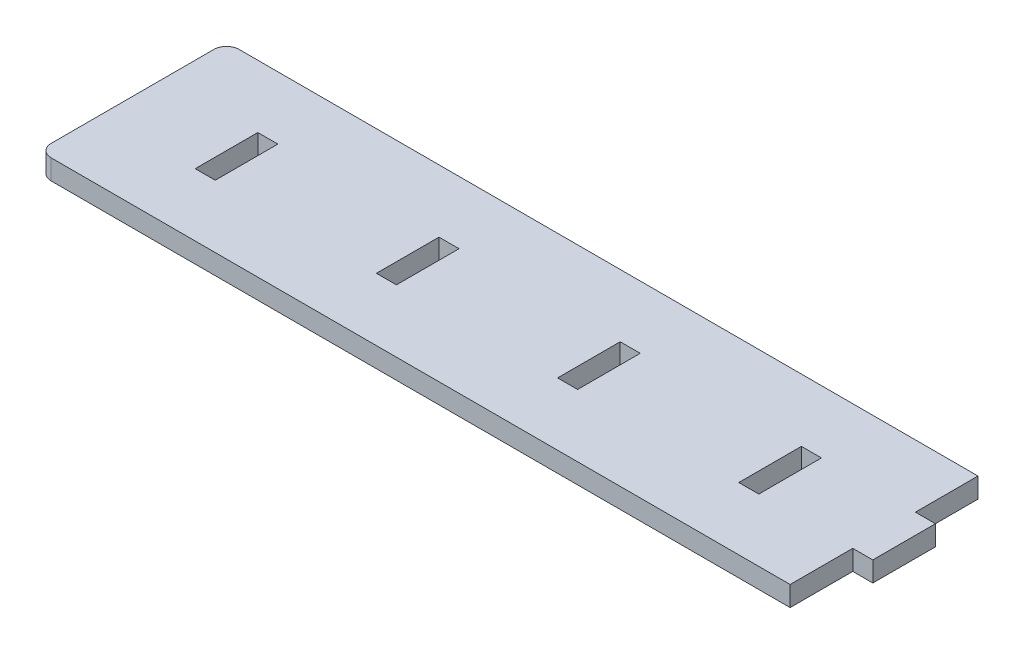
from build123d import *

# Parameters (mm, degrees)
BASE_SKETCH_W       = 3.2
BASE_SKETCH_H       = 10
BOSS_EXTRUDE1_DEPTH = 3.2
FILLET1_R           = 2


with BuildPart() as part:
    # Base_Sketch → Boss-Extrude1 (new body)
    with BuildSketch(Plane(origin=(0, 0, 0), x_dir=(1, 0, 0), z_dir=(0, 1, 0))):
        Polygon((-60, 15), (60, 15), (60, 5), (63.2, 5), (63.2, -5), (60, -5), (60, -15), (-60, -15), align=None)
        with Locations((-14.466666667, 0)):
            Rectangle(BASE_SKETCH_W, BASE_SKETCH_H, mode=Mode.SUBTRACT)
        with Locations((-43.4, 0)):
            Rectangle(BASE_SKETCH_W, BASE_SKETCH_H, mode=Mode.SUBTRACT)
        with Locations((14.466666667, 0)):
            Rectangle(BASE_SKETCH_W, BASE_SKETCH_H, mode=Mode.SUBTRACT)
        with Locations((43.4, 0)):
            Rectangle(BASE_SKETCH_W, BASE_SKETCH_H, mode=Mode.SUBTRACT)
    extrude(amount=BOSS_EXTRUDE1_DEPTH)

    # Fillet1
    fillet1_edges = [part.edges().sort_by_distance(p)[0] for p in [
        (-60, 1.6, 15),
        (-60, 1.6, -15),
    ]]
    fillet(fillet1_edges, radius=FILLET1_R)


solid = part.part
